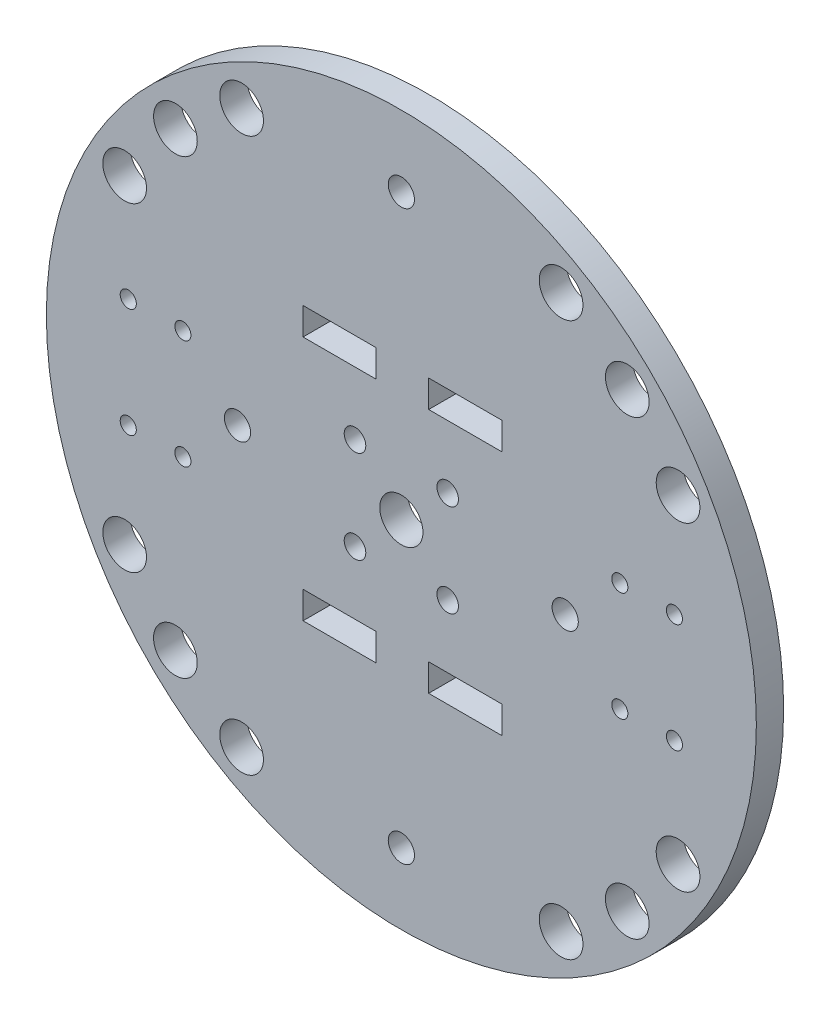
from build123d import *

# Parameters (mm, degrees)
SKETCH1_R           = 65
SKETCH1_R_2         = 3.95
SKETCH1_R_3         = 2.4
SKETCH1_R_4         = 4
SKETCH1_R_5         = 1.475
SKETCH1_R_6         = 1.975
SKETCH1_W           = 13.4
SKETCH1_H           = 5
BOSS_EXTRUDE1_DEPTH = 5


with BuildPart() as part:
    # Sketch1 → Boss-Extrude1 (new body)
    with BuildSketch(Plane.XY):
        Circle(SKETCH1_R)
        Circle(SKETCH1_R_2, mode=Mode.SUBTRACT)
        with Locations((0, 52)):
            Circle(SKETCH1_R_3, mode=Mode.SUBTRACT)
        with Locations((-30, 0)):
            Circle(SKETCH1_R_3, mode=Mode.SUBTRACT)
        with Locations(Location((0, -52, 0), (0, 0, 180))):
            Circle(SKETCH1_R_3, mode=Mode.SUBTRACT)
        with Locations(Location((30, 0, 0), (0, 0, 180))):
            Circle(SKETCH1_R_3, mode=Mode.SUBTRACT)
        with Locations((-41.365746699, 41.365746699)):
            Circle(SKETCH1_R_4, mode=Mode.SUBTRACT)
        with Locations((-29.25, 50.662486121)):
            Circle(SKETCH1_R_4, mode=Mode.SUBTRACT)
        with Locations((-50.662486121, 29.25)):
            Circle(SKETCH1_R_4, mode=Mode.SUBTRACT)
        with Locations(Location((50.662486121, 29.25, 0), (0, 0, 180))):
            Circle(SKETCH1_R_4, mode=Mode.SUBTRACT)
        with Locations(Location((41.365746699, 41.365746699, 0), (0, 0, 180))):
            Circle(SKETCH1_R_4, mode=Mode.SUBTRACT)
        with Locations(Location((29.25, 50.662486121, 0), (0, 0, 180))):
            Circle(SKETCH1_R_4, mode=Mode.SUBTRACT)
        with Locations((50.662486121, -29.25)):
            Circle(SKETCH1_R_4, mode=Mode.SUBTRACT)
        with Locations((41.365746699, -41.365746699)):
            Circle(SKETCH1_R_4, mode=Mode.SUBTRACT)
        with Locations((29.25, -50.662486121)):
            Circle(SKETCH1_R_4, mode=Mode.SUBTRACT)
        with Locations(Location((-29.25, -50.662486121, 0), (0, 0, 180))):
            Circle(SKETCH1_R_4, mode=Mode.SUBTRACT)
        with Locations(Location((-41.365746699, -41.365746699, 0), (0, 0, 180))):
            Circle(SKETCH1_R_4, mode=Mode.SUBTRACT)
        with Locations(Location((-50.662486121, -29.25, 0), (0, 0, 180))):
            Circle(SKETCH1_R_4, mode=Mode.SUBTRACT)
        with Locations((-40, 10)):
            Circle(SKETCH1_R_5, mode=Mode.SUBTRACT)
        with Locations((-50, 10)):
            Circle(SKETCH1_R_5, mode=Mode.SUBTRACT)
        with Locations(Location((-40, -10, 0), (0, 0, 180))):
            Circle(SKETCH1_R_5, mode=Mode.SUBTRACT)
        with Locations(Location((-50, -10, 0), (0, 0, 180))):
            Circle(SKETCH1_R_5, mode=Mode.SUBTRACT)
        with Locations((50, -10)):
            Circle(SKETCH1_R_5, mode=Mode.SUBTRACT)
        with Locations((40, -10)):
            Circle(SKETCH1_R_5, mode=Mode.SUBTRACT)
        with Locations(Location((40, 10, 0), (0, 0, 180))):
            Circle(SKETCH1_R_5, mode=Mode.SUBTRACT)
        with Locations(Location((50, 10, 0), (0, 0, 180))):
            Circle(SKETCH1_R_5, mode=Mode.SUBTRACT)
        with Locations((-8.485281374, 8.485281374)):
            Circle(SKETCH1_R_6, mode=Mode.SUBTRACT)
        with Locations((8.485281374, 8.485281374)):
            Circle(SKETCH1_R_6, mode=Mode.SUBTRACT)
        with Locations((8.485281374, -8.485281374)):
            Circle(SKETCH1_R_6, mode=Mode.SUBTRACT)
        with Locations((-8.485281374, -8.485281374)):
            Circle(SKETCH1_R_6, mode=Mode.SUBTRACT)
        with Locations((11.7, 22.5)):
            Rectangle(SKETCH1_W, SKETCH1_H, mode=Mode.SUBTRACT)
        with Locations((-11.3, 22.5)):
            Rectangle(SKETCH1_W, SKETCH1_H, mode=Mode.SUBTRACT)
        with Locations((11.7, -22.5)):
            Rectangle(SKETCH1_W, SKETCH1_H, mode=Mode.SUBTRACT)
        with Locations((-11.3, -22.5)):
            Rectangle(SKETCH1_W, SKETCH1_H, mode=Mode.SUBTRACT)
    extrude(amount=BOSS_EXTRUDE1_DEPTH)


solid = part.part
